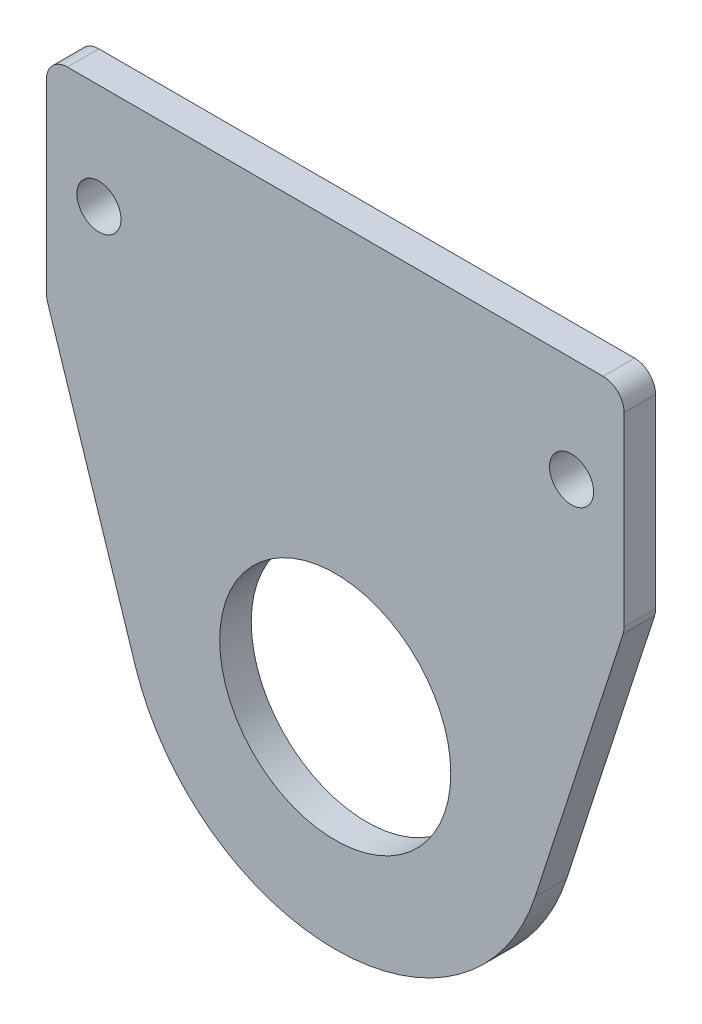
from build123d import *

# Parameters (mm, degrees)
SKETCH_1_W      = 55
SKETCH_1_H      = 20
SKETCH_1_R      = 2.1
SKETCH_1_R_2    = 20
SKETCH_1_R_3    = 11
EXTRUDE_1_DEPTH = 3
FILLET_1_R      = 2


with BuildPart() as part:
    # ｽｹｯﾁ1 → ﾎﾞｽ - 押し出し1 (new body)
    # profile 1 of 4: a face of its own
    with BuildSketch(Plane.XY):
        Rectangle(SKETCH_1_W, SKETCH_1_H)
        with Locations((22.5, 0)):
            Circle(SKETCH_1_R, mode=Mode.SUBTRACT)
        with Locations((-22.5, 0)):
            Circle(SKETCH_1_R, mode=Mode.SUBTRACT)
    # profile 2 of 4: a face of its own
    with BuildSketch(Plane.XY):
        with BuildLine():
            Line((1.9e-08, -10), (-27.5, -10))
            Line((-27.5, -10), (-19.027027027, -36.162162162))
            ThreePointArc((-19.027027027, -36.162162162), (-16.174721681, -18.236566039), (1.9e-08, -10))
        make_face()
    # profile 3 of 4: a face of its own
    with BuildSketch(Plane.XY):
        with Locations((0, -30)):
            Circle(SKETCH_1_R_2)
        with Locations((0, -30)):
            Circle(SKETCH_1_R_3, mode=Mode.SUBTRACT)
    # profile 4 of 4: a face of its own
    with BuildSketch(Plane.XY):
        with BuildLine():
            Line((19.027027027, -36.162162162), (27.5, -10))
            Line((27.5, -10), (1.9e-08, -10))
            ThreePointArc((1.9e-08, -10), (14.14213563, -15.857864383), (20, -30))
            ThreePointArc((20, -30), (19.755259307, -33.119251469), (19.027027027, -36.162162162))
        make_face()
    extrude(amount=EXTRUDE_1_DEPTH)

    # ﾌｨﾚｯﾄ1
    fillet_1_edges = [part.edges().sort_by_distance(p)[0] for p in [
        (27.5, -10, 1.5),
        (-27.5, -10, 1.5),
        (-27.5, 10, 1.5),
        (27.5, 10, 1.5),
    ]]
    fillet(fillet_1_edges, radius=FILLET_1_R)


solid = part.part
